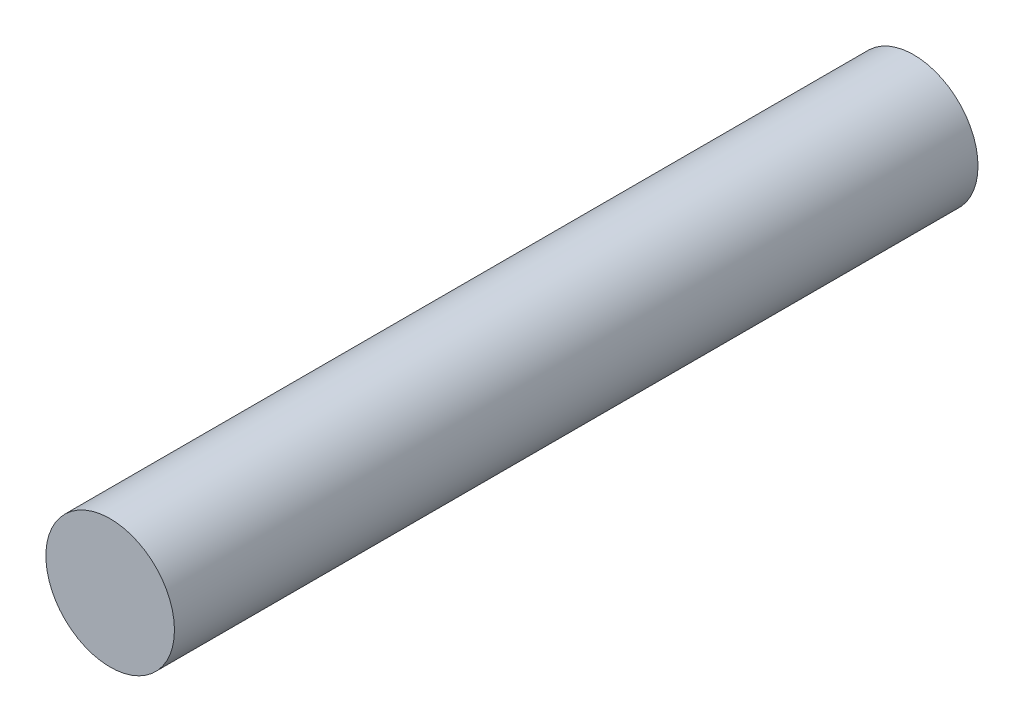
from build123d import *

# Parameters (mm, degrees)
SKETCH_1_R      = 4
EXTRUDE_1_DEPTH = 15
SKETCH_2_R      = 4
EXTRUDE_2_DEPTH = 50
SKETCH_4_R      = 4
EXTRUDE_3_DEPTH = 20


with BuildPart() as part:
    # 草图1 → 凸台-拉伸1 (new body)
    with BuildSketch(Plane.XY):
        Circle(SKETCH_1_R)
    extrude(amount=EXTRUDE_1_DEPTH)


with BuildPart() as body_2:
    # 草图2 → 凸台-拉伸2 (new body)
    with BuildSketch(Plane.XY):
        Circle(SKETCH_2_R)
    extrude(amount=EXTRUDE_2_DEPTH)

    # 草图4 → 凸台-拉伸3 (add)
    with BuildSketch(Plane.XY):
        Circle(SKETCH_4_R)
    extrude(amount=EXTRUDE_3_DEPTH)


solid = Compound([part.part, body_2.part])
